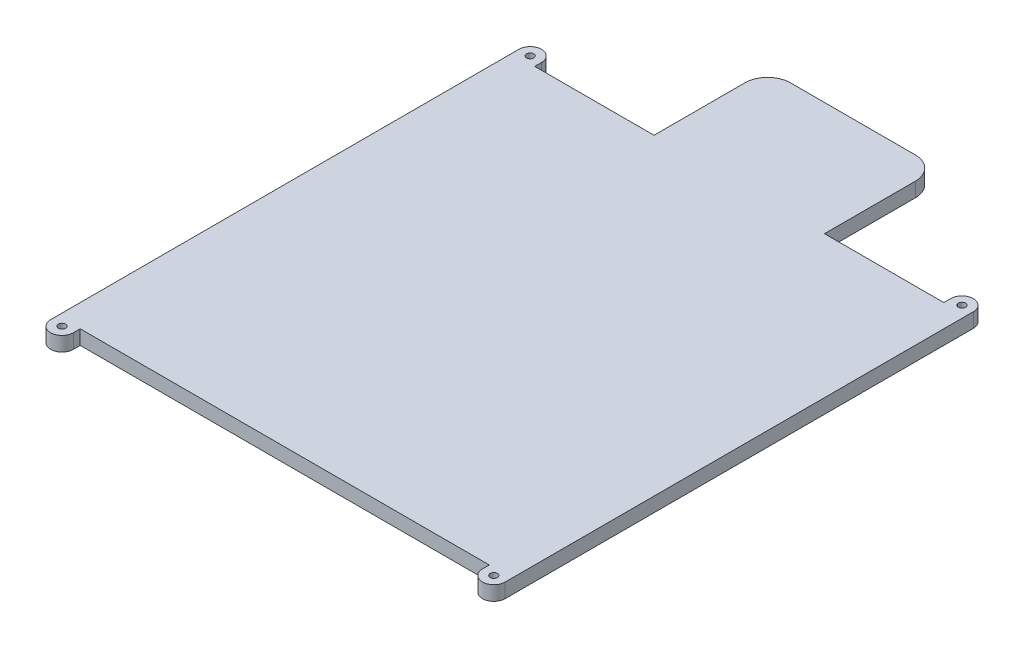
from build123d import *

# Parameters (mm, degrees)
ESQUISSE1_W                = 200
ESQUISSE1_H                = 200
BOSS_EXTRU_1_DEPTH         = 6.35
BOSS_EXTRU_2_DEPTH         = 6.35
ENL_V_MAT_EXTRU_1_REACH    = 149.324
ESQUISSE3_R                = 1.5875
R_P_TITION_LIN_AIRE1_COUNT = 2
R_P_TITION_LIN_AIRE1_PITCH = 190
SYM_TRIE1_COPY_1_DEPTH     = 6.35
SYM_TRIE1_COPY_2_REACH     = 149.324
SYM_TRIE1_COPY_2_SKETCH_R  = 1.5875
ESQUISSE4_W                = 75
ESQUISSE4_H                = 50
BOSS_EXTRU_3_DEPTH         = 6.35
CONG_1_R                   = 10


with BuildPart() as part:
    # Esquisse1 → Boss.-Extru.1 (new body)
    with BuildSketch(Plane(origin=(0, 0, 0), x_dir=(1, 0, 0), z_dir=(0, 1, 0))):
        Rectangle(ESQUISSE1_W, ESQUISSE1_H)
    extrude(amount=BOSS_EXTRU_1_DEPTH)

    # Esquisse2 → Boss.-Extru.2 (add)
    with BuildSketch(Plane(origin=(0, 6.35, 0), x_dir=(1, 0, 0), z_dir=(0, 1, 0))):
        with BuildLine():
            Line((-100, 100), (-90, 100))
            Line((-90, 100), (-90, 103))
            ThreePointArc((-90, 103), (-95, 108), (-100, 103))
            Line((-100, 103), (-100, 100))
        make_face()
    boss_extru_2 = extrude(amount=-BOSS_EXTRU_2_DEPTH)

    # Esquisse3 → Enlèv. mat.-Extru.1 (cut, up to next)
    with BuildSketch(Plane(origin=(0, 6.35, 0), x_dir=(1, 0, 0), z_dir=(0, 1, 0)), mode=Mode.PRIVATE) as enl_v_mat_extru_1_sk1:
        with Locations(Location((-95, 103, 0), (0, 0, 270))):
            Circle(ESQUISSE3_R)
    enl_v_mat_extru_1_tool1 = extrude(enl_v_mat_extru_1_sk1.sketch, amount=-ENL_V_MAT_EXTRU_1_REACH, mode=Mode.PRIVATE) & part.part
    enl_v_mat_extru_1 = enl_v_mat_extru_1_tool1.solids().sort_by_distance((-95, 6.35, -103))[0]
    add(enl_v_mat_extru_1, mode=Mode.SUBTRACT)

    # Répétition linéaire1: Boss.-Extru.2, Enlèv. mat.-Extru.1 ×2
    with Locations(*[(i * R_P_TITION_LIN_AIRE1_PITCH, 0, 0) for i in range(1, R_P_TITION_LIN_AIRE1_COUNT)]):
        add(boss_extru_2)
        add(enl_v_mat_extru_1, mode=Mode.SUBTRACT)

    # Symétrie1: Boss.-Extru.2, Enlèv. mat.-Extru.1 across plane
    add(boss_extru_2.mirror(Plane.XY))
    add(enl_v_mat_extru_1.mirror(Plane.XY), mode=Mode.SUBTRACT)

    # Symétrie1 copy 1 sketch → Symétrie1 copy 1 (add)
    with BuildSketch(Plane(origin=(190, 6.35, 0), x_dir=(1, 0, 0), z_dir=(0, 1, 0))):
        with BuildLine():
            Line((-100, -100), (-90, -100))
            Line((-90, -100), (-90, -103))
            ThreePointArc((-90, -103), (-95, -108), (-100, -103))
            Line((-100, -103), (-100, -100))
        make_face()
    extrude(amount=-SYM_TRIE1_COPY_1_DEPTH)

    # Symétrie1 copy 2 sketch → Symétrie1 copy 2 (cut, up to next)
    with BuildSketch(Plane(origin=(190, 6.35, 0), x_dir=(1, 0, 0), z_dir=(0, 1, 0)), mode=Mode.PRIVATE) as sym_trie1_copy_2_sk1:
        with Locations((-95, -103)):
            Circle(SYM_TRIE1_COPY_2_SKETCH_R)
    sym_trie1_copy_2_tool1 = extrude(sym_trie1_copy_2_sk1.sketch, amount=-SYM_TRIE1_COPY_2_REACH, mode=Mode.PRIVATE) & part.part
    add(sym_trie1_copy_2_tool1.solids().sort_by_distance((95, 6.35, 103))[0], mode=Mode.SUBTRACT)

    # Esquisse4 → Boss.-Extru.3 (add)
    with BuildSketch(Plane(origin=(0, 6.35, 0), x_dir=(1, 0, 0), z_dir=(0, 1, 0))):
        with Locations((0, 125)):
            Rectangle(ESQUISSE4_W, ESQUISSE4_H)
    extrude(amount=-BOSS_EXTRU_3_DEPTH)

    # Congé1
    cong_1_edges = [part.edges().sort_by_distance(p)[0] for p in [
        (-37.5, 3.175, -150),
        (37.5, 3.175, -150),
    ]]
    fillet(cong_1_edges, radius=CONG_1_R)


solid = part.part
